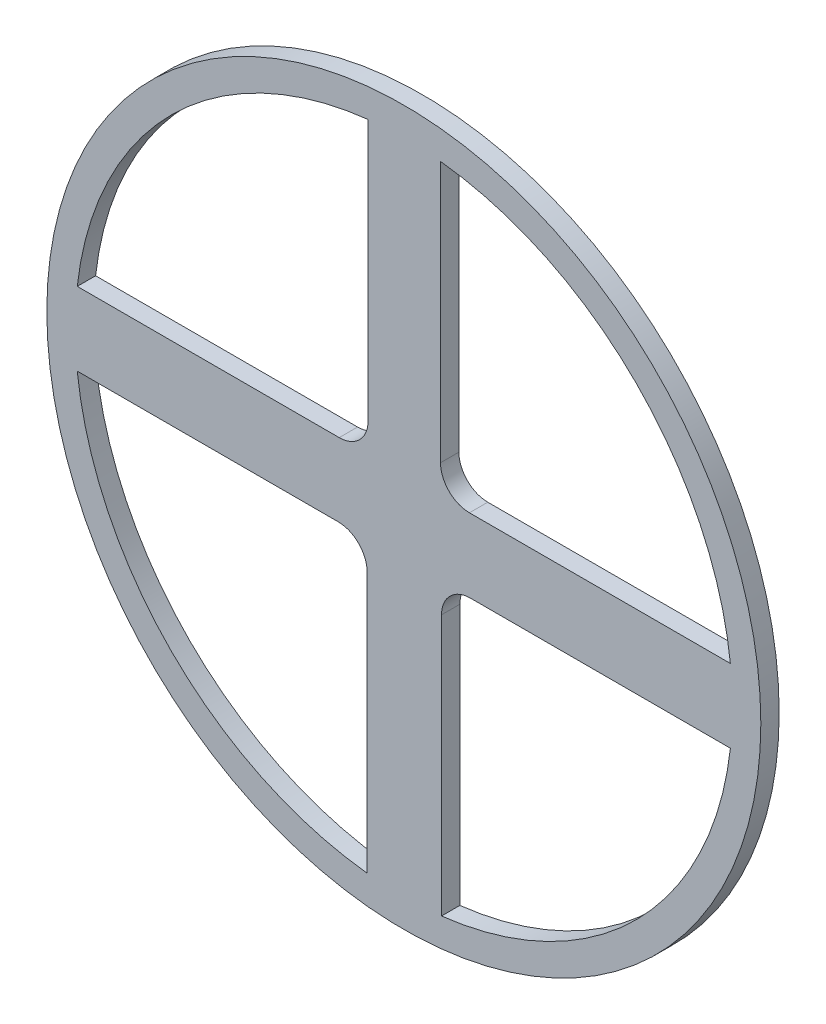
from build123d import *

# Parameters (mm, degrees)
SKETCH1_R           = 123.5325
SKETCH1_R_2         = 113.71
BOSS_EXTRUDE1_DEPTH = 6.35


with BuildPart() as part:
    # Sketch1 → Boss-Extrude1 (new body)
    # profile 1 of 2: a face of its own
    with BuildSketch(Plane.XY):
        Circle(SKETCH1_R)
        Circle(SKETCH1_R_2, mode=Mode.SUBTRACT)
    # profile 2 of 2: a face of its own
    with BuildSketch(Plane.XY):
        with BuildLine():
            ThreePointArc((22.7, 12.7), (15.628932188, 15.628932188), (12.7, 22.7))
            Line((12.7, 22.7), (12.7, 112.998557955))
            ThreePointArc((12.7, 112.998557955), (0.173278497, 113.709867974), (-12.355552704, 113.036739237))
            Line((-12.355552704, 113.036739237), (-12.355552704, 22.7))
            ThreePointArc((-12.355552704, 22.7), (-15.284484892, 15.628932188), (-22.355552704, 12.7))
            Line((-22.355552704, 12.7), (-112.998557955, 12.7))
            ThreePointArc((-112.998557955, 12.7), (-113.71, 0), (-112.998557955, -12.7))
            Line((-112.998557955, -12.7), (-22.7, -12.7))
            ThreePointArc((-22.7, -12.7), (-15.628932188, -15.628932188), (-12.7, -22.7))
            Line((-12.7, -22.7), (-12.7, -112.998557955))
            ThreePointArc((-12.7, -112.998557955), (0.173337872, -113.709867883), (13.044447296, -112.959313448))
            Line((13.044447296, -112.959313448), (13.044447296, -22.7))
            ThreePointArc((13.044447296, -22.7), (15.973379485, -15.628932188), (23.044447296, -12.7))
            Line((23.044447296, -12.7), (112.998557955, -12.7))
            ThreePointArc((112.998557955, -12.7), (113.53200017, -6.359955774), (113.71, 0))
            ThreePointArc((113.71, 0), (113.53200017, 6.359955774), (112.998557955, 12.7))
            Line((112.998557955, 12.7), (22.7, 12.7))
        make_face()
    extrude(amount=BOSS_EXTRUDE1_DEPTH)


solid = part.part
